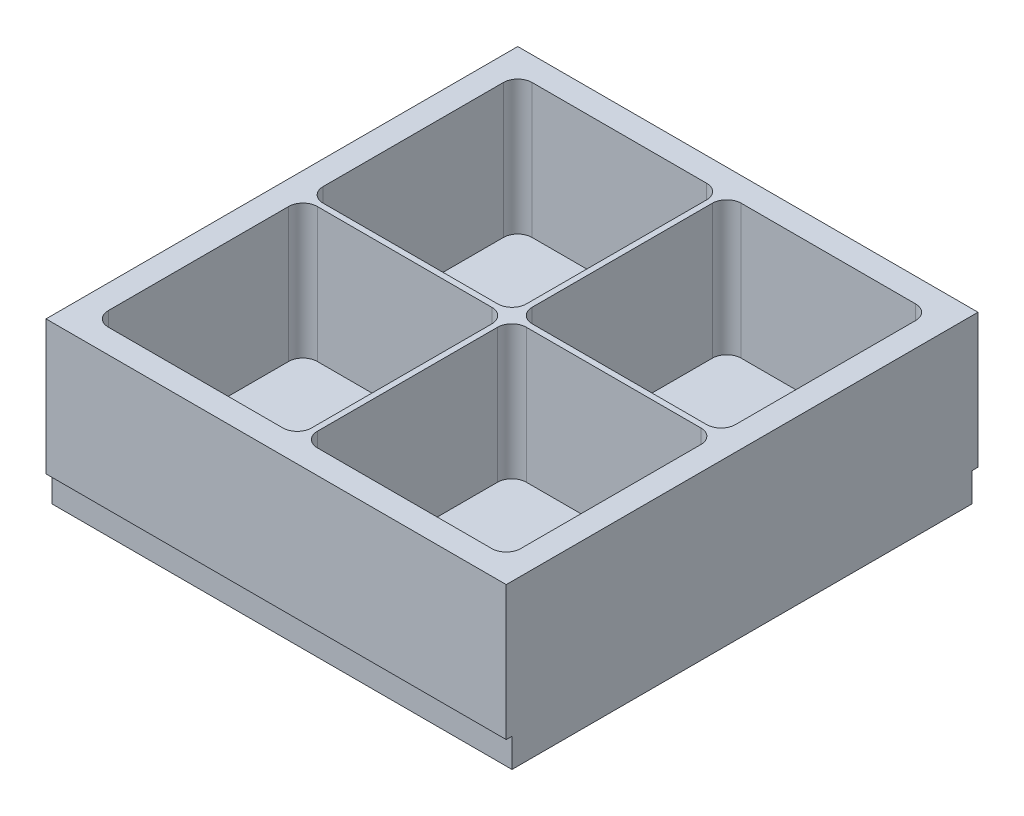
from build123d import *

# Parameters (mm, degrees)
SKETCH1_W           = 96
SKETCH1_H           = 98.4
BOSS_EXTRUDE1_DEPTH = 28
FILLET1_R           = 3
SKETCH2_W           = 96
SKETCH2_H           = 96
BOSS_EXTRUDE2_DEPTH = 6
SKETCH4_R           = 1.1305
CUT_EXTRUDE2_DEPTH  = 4.7
SKETCH6_R           = 5.5
CUT_EXTRUDE3_DEPTH  = 75.22021288


with BuildPart() as part:
    # Sketch1 → Boss-Extrude1 (new body)
    with BuildSketch(Plane(origin=(0, 0, 0), x_dir=(1, 0, 0), z_dir=(0, 1, 0))):
        Rectangle(SKETCH1_W, SKETCH1_H)
        Polygon((-43, -44.2), (-43, -0.6), (-0.6, -0.615), (-0.6, -44.2), align=None, mode=Mode.SUBTRACT)
        Polygon((-43, 44.2), (-0.6, 44.2), (-0.6, 0.615), (-43, 0.6), align=None, mode=Mode.SUBTRACT)
        Polygon((43, -44.2), (43, -0.6), (0.6, -0.615), (0.6, -44.2), align=None, mode=Mode.SUBTRACT)
        Polygon((0.6, 44.2), (43, 44.2), (43, 0.6), (0.6, 0.615), align=None, mode=Mode.SUBTRACT)
    extrude(amount=BOSS_EXTRUDE1_DEPTH)

    # Fillet1
    fillet1_edges = [part.edges().sort_by_distance(p)[0] for p in [
        (-43, 14, 44.2),
        (-0.6, 14, 44.2),
        (-0.6, 14, 0.615),
        (-43, 14, 0.6),
        (-43, 14, -44.2),
        (-43, 14, -0.6),
        (-0.6, 14, -0.615),
        (-0.6, 14, -44.2),
        (43, 14, -0.6),
        (43, 14, -44.2),
        (0.6, 14, -44.2),
        (0.6, 14, -0.615),
        (0.6, 14, 44.2),
        (43, 14, 44.2),
        (43, 14, 0.6),
        (0.6, 14, 0.615),
    ]]
    fillet(fillet1_edges, radius=FILLET1_R)

    # Sketch2 → Boss-Extrude2 (add)
    with BuildSketch(Plane.XZ):
        Rectangle(SKETCH2_W, SKETCH2_H)
    extrude(amount=BOSS_EXTRUDE2_DEPTH)

    # Sketch4 → Cut-Extrude2 (cut)
    with BuildSketch(Plane.XZ.offset(6)):
        with Locations(Location((42.865, -40.005, 0), (0, 0, 270))):
            Circle(SKETCH4_R)
        with Locations(Location((-42.865, -37.465, 0), (0, 0, 270))):
            Circle(SKETCH4_R)
        with Locations(Location((42.865, 40.005, 0), (0, 0, 270))):
            Circle(SKETCH4_R)
        with Locations(Location((-42.865, 36.195, 0), (0, 0, 270))):
            Circle(SKETCH4_R)
    extrude(amount=-CUT_EXTRUDE2_DEPTH, mode=Mode.SUBTRACT)

    # Sketch6 → Cut-Extrude3 (cut, through all)
    with BuildSketch(Plane(origin=(0, 0, 0), x_dir=(1, 0, 0), z_dir=(0, 1, 0))):
        with Locations(Location((-21.8, 22.400530754, 0), (0, 0, 270))):
            Circle(SKETCH6_R)
        with Locations(Location((21.8, 22.400530754, 0), (0, 0, 270))):
            Circle(SKETCH6_R)
        with Locations(Location((21.8, -22.400530754, 0), (0, 0, 270))):
            Circle(SKETCH6_R)
        with Locations(Location((-21.8, -22.400530754, 0), (0, 0, 270))):
            Circle(SKETCH6_R)
    extrude(amount=-CUT_EXTRUDE3_DEPTH, mode=Mode.SUBTRACT)


solid = part.part
